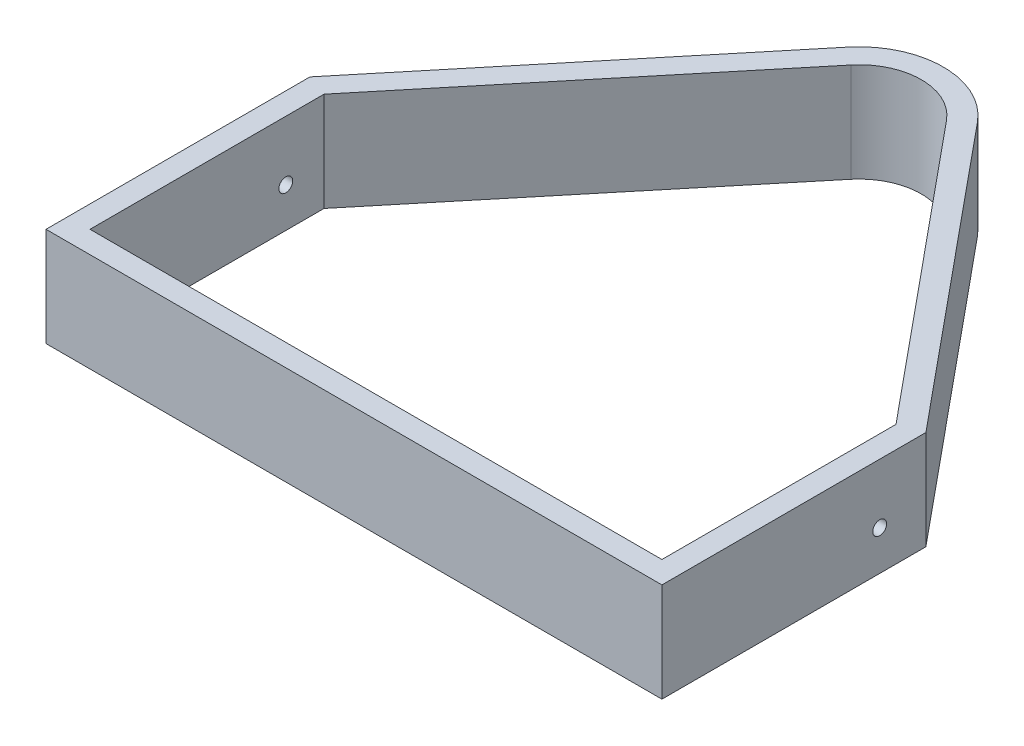
from build123d import *

# Parameters (mm, degrees)
BOSS_EXTRUDE1_DEPTH = 28.575
CUT_EXTRUDE1_REACH  = 278.603
CUT_EXTRUDE1_START  = -82.55
SKETCH2_R           = 2
CUT_EXTRUDE3_REACH  = 278.603
CUT_EXTRUDE3_START  = 82.55
SKETCH2_2_R         = 2


with BuildPart() as part:
    # Sketch1 → Boss-Extrude1 (new body)
    with BuildSketch(Plane(origin=(0, 0, 0), x_dir=(1, 0, 0), z_dir=(0, 1, 0))):
        with BuildLine():
            Line((-88.9, 0), (88.9, 0))
            Line((88.9, 0), (88.9, 76.2))
            Line((88.9, 76.2), (18.702682169, 161.291999073))
            ThreePointArc((18.702682169, 161.291999073), (0, 170.108527998), (-18.702682169, 161.291999073))
            Line((-18.702682169, 161.291999073), (-88.9, 76.2))
            Line((-88.9, 76.2), (-88.9, 0))
        make_face()
        with BuildLine():
            Line((-82.55, 6.35), (-82.55, 73.918790961))
            Line((-82.55, 73.918790961), (-13.804360649, 157.251089982))
            ThreePointArc((-13.804360649, 157.251089982), (0, 163.758527998), (13.804360649, 157.251089982))
            Line((13.804360649, 157.251089982), (82.55, 73.918790961))
            Line((82.55, 73.918790961), (82.55, 6.35))
            Line((82.55, 6.35), (-82.55, 6.35))
        make_face(mode=Mode.SUBTRACT)
    extrude(amount=BOSS_EXTRUDE1_DEPTH)

    # Sketch2 → Cut-Extrude1 (cut, up to next)
    with BuildSketch(Plane(origin=(0, 0, 0), x_dir=(0, 0, -1), z_dir=(1, 0, 0)).offset(CUT_EXTRUDE1_START), mode=Mode.PRIVATE) as cut_extrude1_sk1:
        with Locations((62.869790961, 11.43)):
            Circle(SKETCH2_R)
    cut_extrude1_tool1 = extrude(cut_extrude1_sk1.sketch, amount=-CUT_EXTRUDE1_REACH, mode=Mode.PRIVATE) & part.part
    add(cut_extrude1_tool1.solids().sort_by_distance((-82.55, 11.43, -62.869791))[0], mode=Mode.SUBTRACT)

    # Sketch2<2> → Cut-Extrude3 (cut, up to next)
    with BuildSketch(Plane(origin=(0, 0, 0), x_dir=(0, 0, -1), z_dir=(1, 0, 0)).offset(CUT_EXTRUDE3_START), mode=Mode.PRIVATE) as cut_extrude3_sk1:
        with Locations((62.869790961, 11.43)):
            Circle(SKETCH2_2_R)
    cut_extrude3_tool1 = extrude(cut_extrude3_sk1.sketch, amount=CUT_EXTRUDE3_REACH, mode=Mode.PRIVATE) & part.part
    add(cut_extrude3_tool1.solids().sort_by_distance((82.55, 11.43, -62.869791))[0], mode=Mode.SUBTRACT)


solid = part.part
